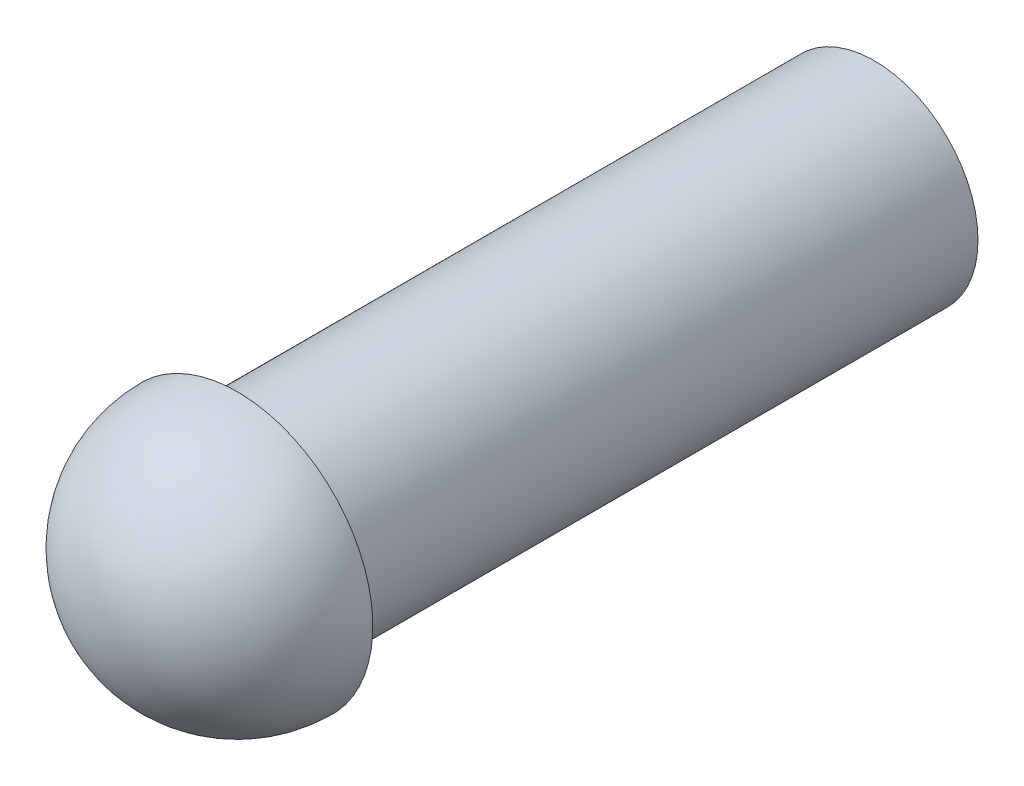
from build123d import *

# Parameters (mm, degrees)
ESQUISSE1_R        = 3.25
BOSS_EXTRU_1_DEPTH = 20
R_VOLUTION1_ANGLE  = 180


with BuildPart() as part:
    # Esquisse1 → Boss.-Extru.1 (new body)
    with BuildSketch(Plane.XY):
        Circle(ESQUISSE1_R)
    extrude(amount=BOSS_EXTRU_1_DEPTH)

    # Esquisse2 → Révolution1 (revolve)
    with BuildSketch(Plane.XY.offset(20)):
        with BuildLine():
            Line((0, -4.25), (0, 4.25))
            ThreePointArc((0, 4.25), (-4.25, 0), (0, -4.25))
        make_face()
    revolve(axis=Axis((0, -4.25, 20), (0, 1, 0)), revolution_arc=R_VOLUTION1_ANGLE)


solid = part.part
